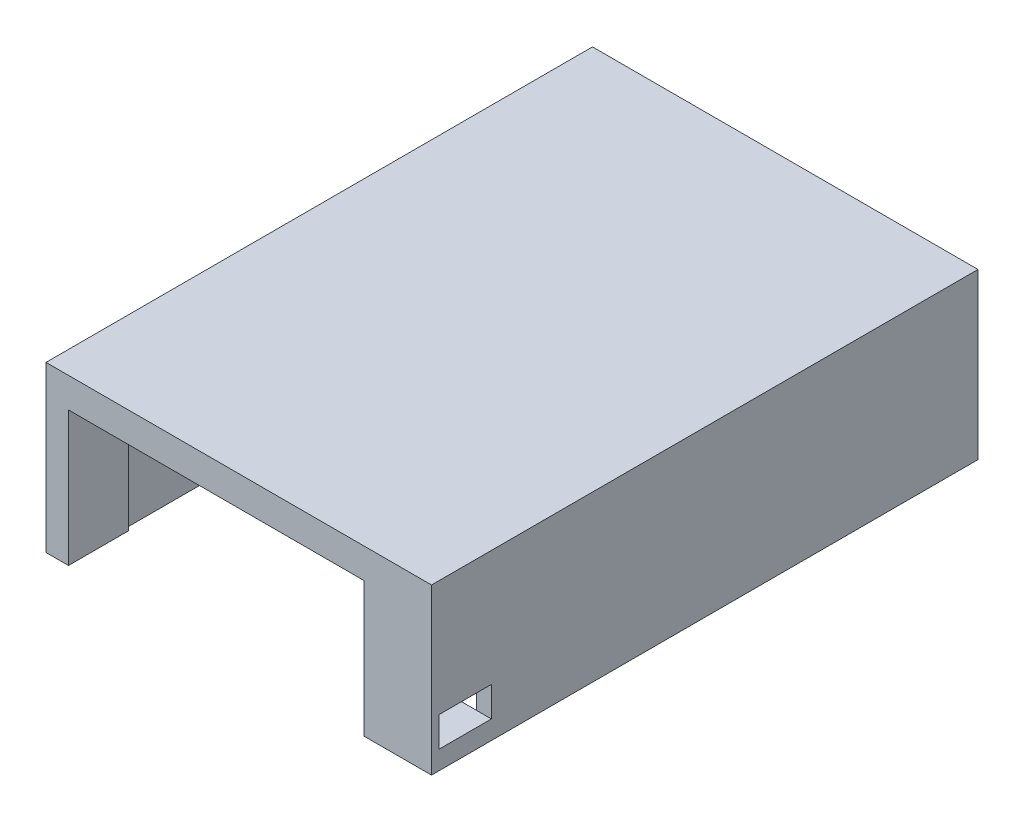
from build123d import *

# Parameters (mm, degrees)
SKETCH1_W           = 51.5
SKETCH1_H           = 73
BOSS_EXTRUDE1_DEPTH = 22
CUT_EXTRUDE1_DEPTH  = 18
SKETCH4_R           = 2
CUT_EXTRUDE2_DEPTH  = 16
SKETCH7_W           = 7
SKETCH7_H           = 4
CUT_EXTRUDE3_DEPTH  = 8.5
SKETCH9_W           = 7
SKETCH9_H           = 4
CUT_EXTRUDE4_DEPTH  = 8.5


with BuildPart() as part:
    # Sketch1 → Boss-Extrude1 (new body)
    with BuildSketch(Plane(origin=(0, 0, 0), x_dir=(1, 0, 0), z_dir=(0, 1, 0))):
        with Locations((-35.624481527, 0.818123821)):
            Rectangle(SKETCH1_W, SKETCH1_H)
    extrude(amount=BOSS_EXTRUDE1_DEPTH)

    # Sketch2 → Cut-Extrude1 (cut)
    with BuildSketch(Plane.XZ):
        Polygon((-58.374481527, 27.681876179), (-58.874481527, 27.681876179), (-58.874481527, -29.318123821), (-52.374481527, -29.318123821), (-52.374481527, -37.318123821), (-12.874481527, -37.318123821), (-12.874481527, -29.318123821), (-11.875874941, -29.318123821), (-11.875874941, 27.681876179), (-18.874481527, 27.681876179), (-18.874481527, 35.681876179), (-54.374481527, 35.681876179), (-58.374481527, 35.681876179), align=None)
    extrude(amount=-CUT_EXTRUDE1_DEPTH, mode=Mode.SUBTRACT)

    # Sketch4 → Cut-Extrude2 (cut)
    with BuildSketch(Plane.XZ):
        with Locations(Location((-15.874481527, 31.681876179, 0), (0, 0, 270))):
            Circle(SKETCH4_R)
        with Locations(Location((-55.374481527, -33.318123821, 0), (0, 0, 270))):
            Circle(SKETCH4_R)
    extrude(amount=-CUT_EXTRUDE2_DEPTH, mode=Mode.SUBTRACT)

    # Sketch7 → Cut-Extrude3 (cut)
    with BuildSketch(Plane.ZY.offset(61.374481527)):
        with Locations((-32.818123821, 4.5)):
            Rectangle(SKETCH7_W, SKETCH7_H)
    extrude(amount=-CUT_EXTRUDE3_DEPTH, mode=Mode.SUBTRACT)

    # Sketch9 → Cut-Extrude4 (cut)
    with BuildSketch(Plane(origin=(-9.874481527, 0, 0), x_dir=(0, 0, -1), z_dir=(1, 0, 0))):
        with Locations((-31.181876179, 4.5)):
            Rectangle(SKETCH9_W, SKETCH9_H)
    extrude(amount=-CUT_EXTRUDE4_DEPTH, mode=Mode.SUBTRACT)


solid = part.part
